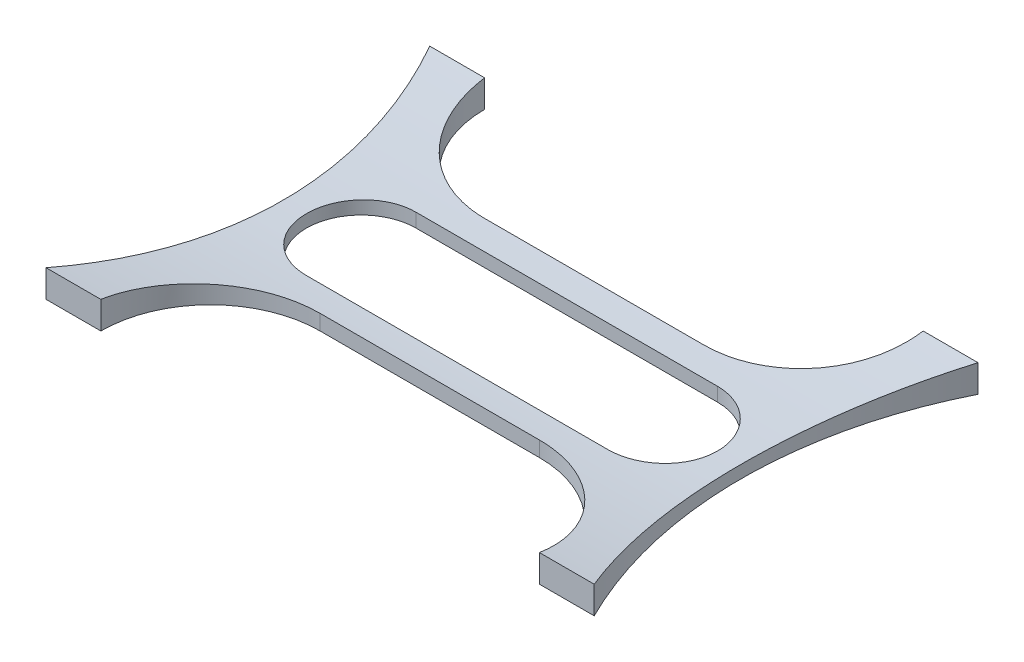
from build123d import *

# Parameters (mm, degrees)
BOSS_EXTRU_1_DEPTH           = 10
ENL_V_MAT_EXTRU_1_DEPTH      = 123.474487139
ENL_V_MAT_EXTRU_1_DEPTH_BACK = 123.474487139


with BuildPart() as part:
    # Esquisse1 → Boss.-Extru.1 (new body)
    with BuildSketch(Plane(origin=(0, 0, 0), x_dir=(1, 0, 0), z_dir=(0, 1, 0))):
        with BuildLine():
            Line((-100, 70), (-80, 70))
            ThreePointArc((-80, 70), (-68.284271247, 41.715728753), (-40, 30))
            Line((-40, 30), (40, 30))
            ThreePointArc((40, 30), (68.284271247, 41.715728753), (80, 70))
            Line((80, 70), (100, 70))
            ThreePointArc((100, 70), (83.475241575, 0), (100, -70))
            Line((100, -70), (80, -70))
            ThreePointArc((80, -70), (68.284271247, -41.715728753), (40, -30))
            Line((40, -30), (-40, -30))
            ThreePointArc((-40, -30), (-68.284271247, -41.715728753), (-80, -70))
            Line((-80, -70), (-100, -70))
            ThreePointArc((-100, -70), (-83.475241575, 0), (-100, 70))
        make_face()
        with BuildLine():
            Line((55, -20), (-55, -20))
            ThreePointArc((-55, -20), (-75, 0), (-55, 20))
            Line((-55, 20), (55, 20))
            ThreePointArc((55, 20), (75, 0), (55, -20))
        make_face(mode=Mode.SUBTRACT)
    extrude(amount=BOSS_EXTRU_1_DEPTH)

    # Esquisse2 → Enlèv. mat.-Extru.1 (cut, two sides: drawn at the far end of the back side and taken through both)
    with BuildSketch(Plane(origin=(0, 0, 0), x_dir=(0, 0, -1), z_dir=(1, 0, 0)).offset(-ENL_V_MAT_EXTRU_1_DEPTH_BACK)):
        with BuildLine():
            Line((70, 10), (0, 10))
            Line((0, 10), (0, 4.588098531))
            ThreePointArc((0, 4.588098531), (35.104446576, 5.943089657), (70, 10))
        make_face()
        with BuildLine():
            Line((0, 4.588098531), (0, 10))
            Line((0, 10), (-70, 10))
            ThreePointArc((-70, 10), (-35.104446576, 5.943089657), (0, 4.588098531))
        make_face()
        with BuildLine():
            Line((70, 10), (0, 10))
            Line((0, 10), (0, 4.588098531))
            ThreePointArc((0, 4.588098531), (35.104446576, 5.943089657), (70, 10))
        make_face()
        with BuildLine():
            Line((0, 4.588098531), (0, 10))
            Line((0, 10), (-70, 10))
            ThreePointArc((-70, 10), (-35.104446576, 5.943089657), (0, 4.588098531))
        make_face()
    extrude(amount=ENL_V_MAT_EXTRU_1_DEPTH + ENL_V_MAT_EXTRU_1_DEPTH_BACK, mode=Mode.SUBTRACT)


solid = part.part
